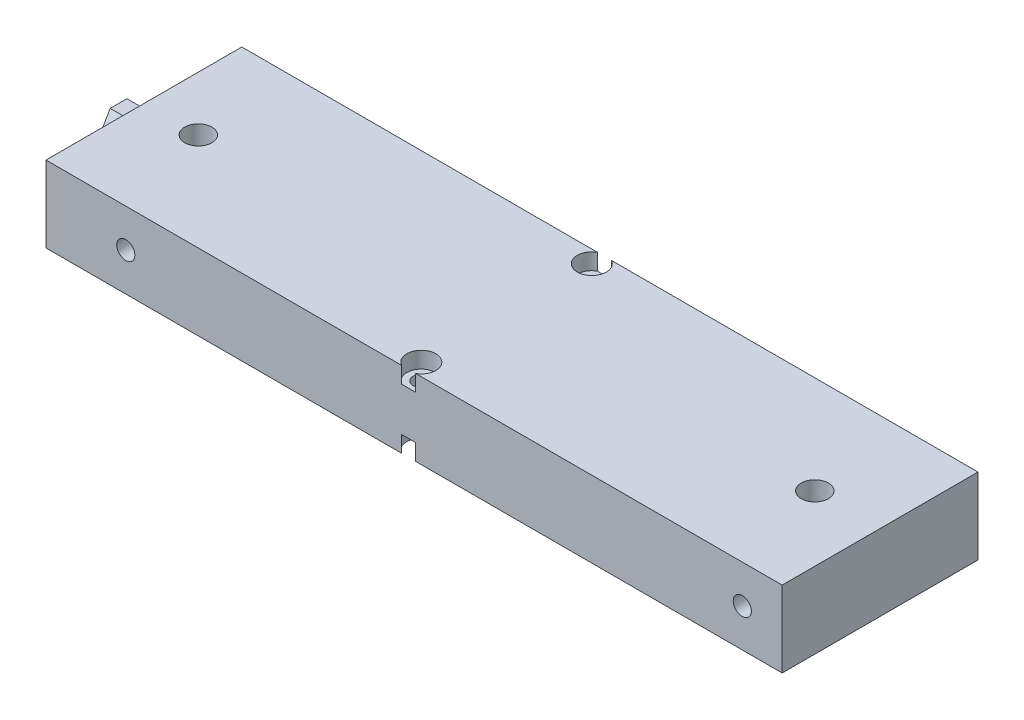
from build123d import *

# Parameters (mm, degrees)
SKETCH_1_W          = 203
SKETCH_1_H          = 54
EXTRUDE_1_DEPTH     = 21
SKETCH_2_R          = 4
CUT_EXTRUDE_1_DEPTH = 150
SKETCH_3_R          = 2.25
CUT_EXTRUDE_2_DEPTH = 212.106608139
SKETCH_4_R          = 4
CUT_EXTRUDE_3_DEPTH = 4.5
SKETCH_5_R          = 3.75
CUT_EXTRUDE_4_DEPTH = 7.2
SKETCH_6_R          = 2.5
CUT_EXTRUDE_5_DEPTH = 5
EXTRUDE_2_DEPTH     = 7


with BuildPart() as part:
    # 草图1 → 凸台-拉伸1 (new body)
    with BuildSketch(Plane(origin=(0, 0, 0), x_dir=(1, 0, 0), z_dir=(0, 1, 0))):
        with Locations((101.5, 27)):
            Rectangle(SKETCH_1_W, SKETCH_1_H)
    extrude(amount=EXTRUDE_1_DEPTH)

    # 草图2 → 切除-拉伸1 (cut)
    with BuildSketch(Plane.ZY):
        with Locations((-15, 10.5)):
            Circle(SKETCH_2_R)
        with Locations(Location((-39, 10.5, 0), (0, 0, 180))):
            Circle(SKETCH_2_R)
    extrude(amount=-CUT_EXTRUDE_1_DEPTH, mode=Mode.SUBTRACT)

    # 草图3 → 切除-拉伸2 (cut, through all)
    with BuildSketch(Plane(origin=(0, 21, 0), x_dir=(1, 0, 0), z_dir=(0, 1, 0))):
        with Locations(Location((100, 3.5, 0), (0, 0, 270))):
            Circle(SKETCH_3_R)
        with Locations(Location((100, 50.5, 0), (0, 0, 270))):
            Circle(SKETCH_3_R)
        with Locations(Location((15, 27, 0), (0, 0, 270))):
            Circle(SKETCH_3_R)
        with Locations(Location((185, 27, 0), (0, 0, 270))):
            Circle(SKETCH_3_R)
    extrude(amount=-CUT_EXTRUDE_2_DEPTH, mode=Mode.SUBTRACT)

    # 草图4 → 切除-拉伸3 (cut)
    with BuildSketch(Plane(origin=(0, 21, 0), x_dir=(1, 0, 0), z_dir=(0, 1, 0))):
        with Locations((100, 50.5)):
            Circle(SKETCH_4_R)
        with Locations((100, 3.5)):
            Circle(SKETCH_4_R)
    cut_extrude_3 = extrude(amount=-CUT_EXTRUDE_3_DEPTH, mode=Mode.SUBTRACT)

    # 草图5 → 切除-拉伸4 (cut)
    with BuildSketch(Plane(origin=(0, 21, 0), x_dir=(1, 0, 0), z_dir=(0, 1, 0))):
        with Locations(Location((185, 27, 0), (0, 0, 270))):
            Circle(SKETCH_5_R)
        with Locations(Location((15, 27, 0), (0, 0, 270))):
            Circle(SKETCH_5_R)
    cut_extrude_4 = extrude(amount=-CUT_EXTRUDE_4_DEPTH, mode=Mode.SUBTRACT)

    # 镜向1: 切除-拉伸3, 切除-拉伸4 across plane
    add(cut_extrude_3.mirror(Plane(origin=(0, 10.5, 0), x_dir=(0, 0, 1), z_dir=(0, -1, 0))), mode=Mode.SUBTRACT)
    add(cut_extrude_4.mirror(Plane(origin=(0, 10.5, 0), x_dir=(0, 0, 1), z_dir=(0, -1, 0))), mode=Mode.SUBTRACT)

    # 草图6 → 切除-拉伸5 (cut)
    with BuildSketch(Plane.XY):
        with Locations((22, 10.5)):
            Circle(SKETCH_6_R)
        with Locations((192, 10.5)):
            Circle(SKETCH_6_R)
    extrude(amount=-CUT_EXTRUDE_5_DEPTH, mode=Mode.SUBTRACT)

    # 草图7 → 凸台-拉伸2 (add)
    with BuildSketch(Plane.ZY):
        Polygon((-24.690598923, 17.5), (-29.309401077, 17.5), (-31.618802154, 13.5), (-29.309401077, 9.5), (-24.690598923, 9.5), (-22.381197846, 13.5), align=None)
    extrude(amount=EXTRUDE_2_DEPTH)


solid = part.part
